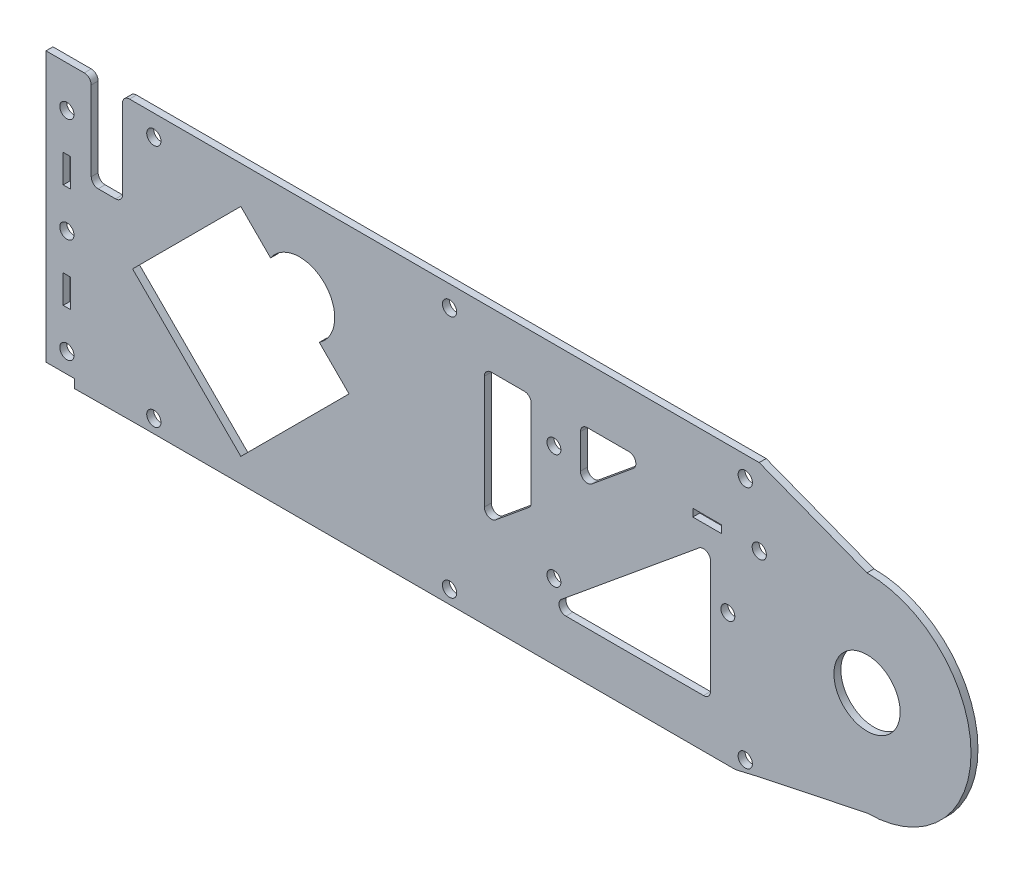
from build123d import *

# Parameters (mm, degrees)
SKETCH_1_R          = 2.05
SKETCH_1_R_2        = 9.525
SKETCH_1_W          = 2.1
SKETCH_1_H          = 8.1
EXTRUDE_1_DEPTH     = 2
FILLET_1_R          = 2
SKETCH_3_R          = 2.05
SKETCH_3_R_2        = 2
SKETCH_3_W          = 8.2
SKETCH_3_H          = 2.2
CUT_EXTRUDE_1_DEPTH = 2
FILLET_2_R          = 2


with BuildPart() as part:
    # 草图1 → 凸台-拉伸1 (new body)
    with BuildSketch(Plane.XY):
        with BuildLine():
            Line((230.542857143, -30.045714286), (199.556073527, -36.55591431))
            Line((199.556073527, -36.55591431), (192.746868021, -38.145714286))
            Line((192.746868021, -38.145714286), (21.365844759, -38.145714286))
            Line((21.365844759, -38.145714286), (2.692857143, -38.295714286))
            Line((2.692857143, -38.295714286), (2.692857143, -35.802553436))
            Line((2.692857143, -35.802553436), (-5.457142857, -35.802553436))
            Line((-5.457142857, -35.802553436), (-5.457142857, 41.704285714))
            Line((-5.457142857, 41.704285714), (7.542857143, 41.704285714))
            Line((7.542857143, 41.704285714), (7.542857143, 14.854285714))
            Line((7.542857143, 14.854285714), (16.542857143, 14.854285714))
            Line((16.542857143, 14.854285714), (16.542857143, 41.704285714))
            Line((16.542857143, 41.704285714), (199.542857143, 41.704285714))
            Line((199.542857143, 41.704285714), (230.542857143, 29.754285714))
            ThreePointArc((230.542857143, 29.754285714), (260.442857143, -0.145714286), (230.542857143, -30.045714286))
        make_face()
        with Locations((0.542857143, 29.854285714)):
            Circle(SKETCH_1_R, mode=Mode.SUBTRACT)
        with Locations((0.542857143, -0.145714286)):
            Circle(SKETCH_1_R, mode=Mode.SUBTRACT)
        with Locations((0.542857143, -30.145714286)):
            Circle(SKETCH_1_R, mode=Mode.SUBTRACT)
        with Locations((230.542857143, -0.145714286)):
            Circle(SKETCH_1_R_2, mode=Mode.SUBTRACT)
        with Locations((0.542857143, 14.854285714)):
            Rectangle(SKETCH_1_W, SKETCH_1_H, mode=Mode.SUBTRACT)
        with BuildLine():
            Line((59.099206329, 22.4106349), (50.542857143, 30.966984086))
            Line((50.542857143, 30.966984086), (19.430158771, -0.145714286))
            Line((19.430158771, -0.145714286), (50.542857143, -31.258412658))
            Line((50.542857143, -31.258412658), (81.655555515, -0.145714286))
            Line((81.655555515, -0.145714286), (73.099206329, 8.4106349))
            ThreePointArc((73.099206329, 8.4106349), (74.584487703, 23.895916275), (59.099206329, 22.4106349))
        make_face(mode=Mode.SUBTRACT)
        with Locations((0.542857143, -15.145714286)):
            Rectangle(SKETCH_1_W, SKETCH_1_H, mode=Mode.SUBTRACT)
    extrude(amount=EXTRUDE_1_DEPTH)

    # 圆角1
    fillet_1_edges = [part.edges().sort_by_distance(p)[0] for p in [
        (7.542857143, 41.704285714, 1),
        (7.542857143, 14.854285714, 1),
        (16.542857143, 14.854285714, 1),
        (16.542857143, 41.704285714, 1),
    ]]
    fillet(fillet_1_edges, radius=FILLET_1_R)

    # 草图3 → 切除-拉伸1 (cut)
    with BuildSketch(Plane.XY.offset(2)):
        with Locations((25.542857143, 35.704285714)):
            Circle(SKETCH_3_R)
        with Locations((110.542857143, 35.704285714)):
            Circle(SKETCH_3_R)
        with Locations((195.542857143, 35.704285714)):
            Circle(SKETCH_3_R)
        with Locations((110.542857143, -34.295714286)):
            Circle(SKETCH_3_R)
        with Locations((195.542857143, -34.295714286)):
            Circle(SKETCH_3_R)
        with Locations((25.542857143, -34.295714286)):
            Circle(SKETCH_3_R)
        with Locations((190.542857143, -0.145714286)):
            Circle(SKETCH_3_R_2)
        with Locations((140.542857143, 16.354285714)):
            Circle(SKETCH_3_R_2)
        with Locations(Location((140.542857143, -16.645714286, 0), (0, 0, 180))):
            Circle(SKETCH_3_R_2)
        with Locations((199.574018739, 19.704285714)):
            Circle(SKETCH_3_R)
        Polygon((148.153334198, 25.704285714), (148.153334198, 9.632158315), (167.669488896, 25.704285714), align=None)
        Polygon((185.542857143, -24.295714286), (138.41622539, -24.295714286), (185.542857143, 14.51445304), align=None)
        Polygon((120.542857143, -13.105881612), (120.542857143, 25.704285714), (134.014872528, 25.704285714), (134.014872528, -2.011280706), align=None)
        with Locations((184.574018739, 19.704285714)):
            Rectangle(SKETCH_3_W, SKETCH_3_H)
    extrude(amount=-CUT_EXTRUDE_1_DEPTH, mode=Mode.SUBTRACT)

    # 圆角2
    fillet_2_edges = [part.edges().sort_by_distance(p)[0] for p in [
        (167.669488896, 25.704285714, 1),
        (148.153334198, 9.632158315, 1),
        (148.153334198, 25.704285714, 1),
        (120.542857143, 25.704285714, 1),
        (134.014872528, 25.704285714, 1),
        (134.014872528, -2.011280706, 1),
        (120.542857143, -13.105881612, 1),
        (185.542857143, 14.51445304, 1),
        (185.542857143, -24.295714286, 1),
        (138.41622539, -24.295714286, 1),
    ]]
    fillet(fillet_2_edges, radius=FILLET_2_R)


solid = part.part
